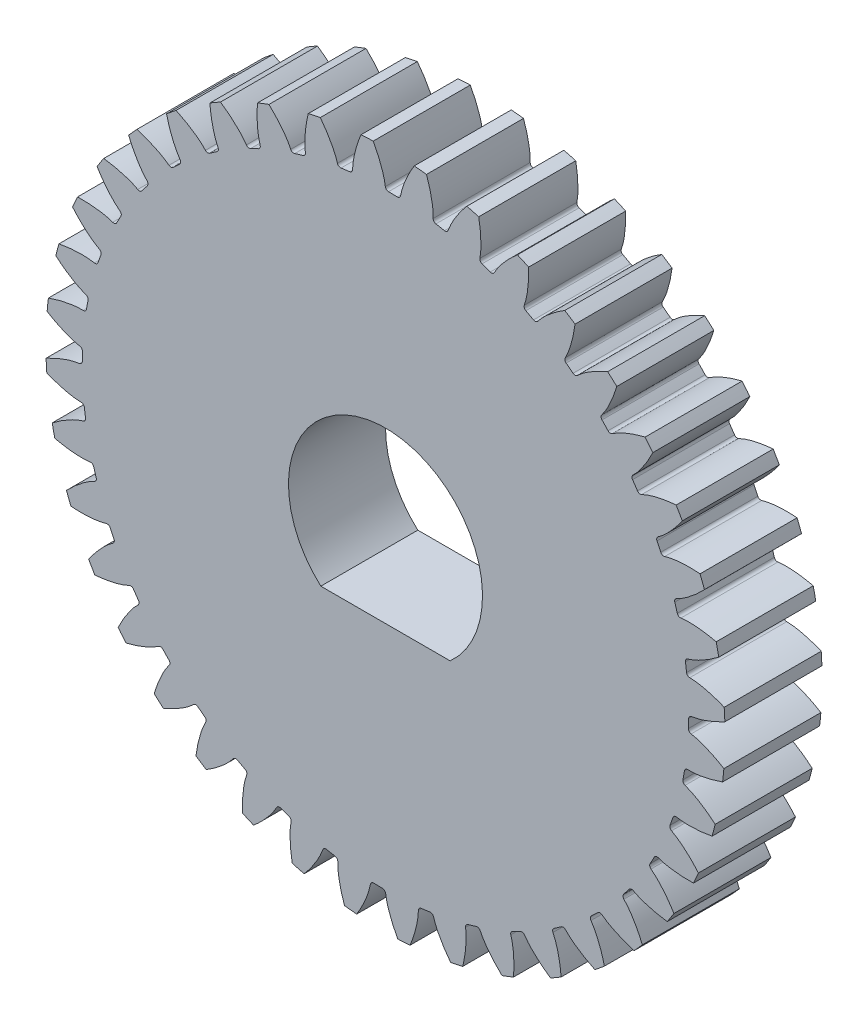
from build123d import *

# Parameters (mm, degrees)
SKETCH1_R                 = 10.5
BOSS_EXTRUDE1_DEPTH       = 3
CUT_EXTRUDE1_DEPTH        = 16.149257408
FILLET1_R                 = 0.1
FILLET2_R                 = 0.1
CIRPATTERN14_COUNT        = 40
FILLET1_OF_CIRPATTERN14_R = 0.1
FILLET2_OF_CIRPATTERN14_R = 0.1


with BuildPart() as part:
    # Sketch1 → Boss-Extrude1 (new body)
    with BuildSketch(Plane.XY):
        Circle(SKETCH1_R)
        with BuildLine():
            Line((-2, -2.236067977), (2, -2.236067977))
            ThreePointArc((2, -2.236067977), (0, 3), (-2, -2.236067977))
        make_face(mode=Mode.SUBTRACT)
    extrude(amount=BOSS_EXTRUDE1_DEPTH)

    # Sketch3 → Cut-Extrude1 (cut, symmetric)
    with BuildSketch(Plane.XY):
        with BuildLine():
            Line((9.396926208, 0), (9.375, 0))
            ThreePointArc((9.375, 0), (9.372217268, -0.228404189), (9.363870726, -0.456672786))
            Line((9.363870726, -0.456672786), (9.385770904, -0.45774085))
            add(Edge.make_bspline(
                [(9.385770904, -0.45774085), (9.388977215, -0.457943492), (9.397960888, -0.458654691), (9.414905327, -0.460563121), (9.442478718, -0.464476435), (9.47748544, -0.470635501), (9.52255904, -0.479939311), (9.575407121, -0.492622222), (9.63319062, -0.50835926), (9.69570317, -0.527414092), (9.757728925, -0.548127815), (9.819261178, -0.570369728), (9.880232496, -0.593946192), (9.953677701, -0.624174352), (10.041157255, -0.662737018), (10.142479128, -0.711159995), (10.256243532, -0.77001319), (10.351353223, -0.82324166), (10.41648326, -0.861502087), (10.453362572, -0.883819497), (10.462276562, -0.88925201)],
                knots=[0, 0, 0, 0, 0, 0.005376749, 0.015083688, 0.02853182, 0.04661014, 0.064854849, 0.092110525, 0.119476176, 0.146842496, 0.174208854, 0.201574956, 0.228941013, 0.256307345, 0.307035032, 0.361767352, 0.416499661, 0.471231937, 0.488701645, 0.488701645, 0.488701645, 0.488701645, 0.488701645], degree=4))
            ThreePointArc((10.462276562, -0.88925201), (10.490564901, -0.445025897), (10.5, 0))
            ThreePointArc((10.5, 0), (10.498293259, 0.189310979), (10.493173591, 0.378560413))
            add(Edge.make_bspline(
                [(9.396926208, 0), (9.400138583, 4.6216e-05), (9.409146235, 0.000318961), (9.426163522, 0.001399731), (9.453894805, 0.003965251), (9.489159988, 0.008411766), (9.534633285, 0.015508917), (9.588036436, 0.025602449), (9.646517918, 0.038506069), (9.709884453, 0.054493183), (9.772845578, 0.072160933), (9.835388227, 0.091379097), (9.897435615, 0.111957553), (9.972266099, 0.138572183), (10.06152026, 0.172827787), (10.16508062, 0.216257712), (10.281576815, 0.269499377), (10.379166451, 0.318031698), (10.446082904, 0.353074106), (10.484005556, 0.373568566), (10.493173591, 0.378560413)],
                knots=[0, 0, 0, 0, 0, 0.005376749, 0.015083688, 0.02853182, 0.04661014, 0.064854849, 0.092110525, 0.119476176, 0.146842496, 0.174208854, 0.201574956, 0.228941013, 0.256307345, 0.307035032, 0.361767352, 0.416499661, 0.471231937, 0.488701645, 0.488701645, 0.488701645, 0.488701645, 0.488701645], degree=4))
        make_face()
    cut_extrude1 = extrude(amount=CUT_EXTRUDE1_DEPTH, both=True, mode=Mode.SUBTRACT)

    # Fillet1
    fillet1_edges = [part.edges().sort_by_distance(p)[0] for p in [
        (9.363870726, -0.456672786, 1.5),
    ]]
    fillet(fillet1_edges, radius=FILLET1_R)

    # Fillet2
    fillet2_edges = [part.edges().sort_by_distance(p)[0] for p in [
        (9.375, 0, 1.5),
    ]]
    fillet(fillet2_edges, radius=FILLET2_R)

    # CirPattern14: Cut-Extrude1 ×40 about axis
    cirpattern14_axis = Axis((0, 0, 3), (0, 0, -1))
    for i in range(1, CIRPATTERN14_COUNT):
        add(cut_extrude1.rotate(cirpattern14_axis, i * 360 / CIRPATTERN14_COUNT), mode=Mode.SUBTRACT)

    # Fillet1 of CirPattern14
    fillet1_of_cirpattern14_edges = [part.edges().sort_by_distance(p)[0] for p in [
        (9.177146576, -1.915882494, 1.5),
        (8.76445062, -3.327916816, 1.5),
        (8.135944802, -4.658006782, 1.5),
        (7.307105021, -5.873401162, 1.5),
        (6.298340065, -6.944172912, 1.5),
        (5.134489072, -7.843956079, 1.5),
        (3.844209919, -8.550595015, 1.5),
        (2.459273558, -9.046689923, 1.5),
        (1.013781722, -9.320025302, 1.5),
        (-0.456672786, -9.363870726, 1.5),
        (-1.915882494, -9.177146576, 1.5),
        (-3.327916816, -8.76445062, 1.5),
        (-4.658006782, -8.135944802, 1.5),
        (-5.873401162, -7.307105021, 1.5),
        (-6.944172912, -6.298340065, 1.5),
        (-7.843956079, -5.134489072, 1.5),
        (-8.550595015, -3.844209919, 1.5),
        (-9.046689923, -2.459273558, 1.5),
        (-9.320025302, -1.013781722, 1.5),
        (-9.363870726, 0.456672786, 1.5),
        (-9.177146576, 1.915882494, 1.5),
        (-8.76445062, 3.327916816, 1.5),
        (-8.135944802, 4.658006782, 1.5),
        (-7.307105021, 5.873401162, 1.5),
        (-6.298340065, 6.944172912, 1.5),
        (-5.134489072, 7.843956079, 1.5),
        (-3.844209919, 8.550595015, 1.5),
        (-2.459273558, 9.046689923, 1.5),
        (-1.013781722, 9.320025302, 1.5),
        (0.456672786, 9.363870726, 1.5),
        (1.915882494, 9.177146576, 1.5),
        (3.327916816, 8.76445062, 1.5),
        (4.658006782, 8.135944802, 1.5),
        (5.873401162, 7.307105021, 1.5),
        (6.944172912, 6.298340065, 1.5),
        (7.843956079, 5.134489072, 1.5),
        (8.550595015, 3.844209919, 1.5),
        (9.046689923, 2.459273558, 1.5),
        (9.320025302, 1.013781722, 1.5),
    ]]
    fillet(fillet1_of_cirpattern14_edges, radius=FILLET1_OF_CIRPATTERN14_R)

    # Fillet2 of CirPattern14
    fillet2_of_cirpattern14_edges = [part.edges().sort_by_distance(p)[0] for p in [
        (9.259578193, -1.46657311, 1.5),
        (8.91615484, -2.897034322, 1.5),
        (8.353186164, -4.256160935, 1.5),
        (7.584534322, -5.51048674, 1.5),
        (6.629126074, -6.629126074, 1.5),
        (5.51048674, -7.584534322, 1.5),
        (4.256160935, -8.353186164, 1.5),
        (2.897034322, -8.91615484, 1.5),
        (1.46657311, -9.259578193, 1.5),
        (0, -9.375, 1.5),
        (-1.46657311, -9.259578193, 1.5),
        (-2.897034322, -8.91615484, 1.5),
        (-4.256160935, -8.353186164, 1.5),
        (-5.51048674, -7.584534322, 1.5),
        (-6.629126074, -6.629126074, 1.5),
        (-7.584534322, -5.51048674, 1.5),
        (-8.353186164, -4.256160935, 1.5),
        (-8.91615484, -2.897034322, 1.5),
        (-9.259578193, -1.46657311, 1.5),
        (-9.375, 0, 1.5),
        (-9.259578193, 1.46657311, 1.5),
        (-8.91615484, 2.897034322, 1.5),
        (-8.353186164, 4.256160935, 1.5),
        (-7.584534322, 5.51048674, 1.5),
        (-6.629126074, 6.629126074, 1.5),
        (-5.51048674, 7.584534322, 1.5),
        (-4.256160935, 8.353186164, 1.5),
        (-2.897034322, 8.91615484, 1.5),
        (-1.46657311, 9.259578193, 1.5),
        (0, 9.375, 1.5),
        (1.46657311, 9.259578193, 1.5),
        (2.897034322, 8.91615484, 1.5),
        (4.256160935, 8.353186164, 1.5),
        (5.51048674, 7.584534322, 1.5),
        (6.629126074, 6.629126074, 1.5),
        (7.584534322, 5.51048674, 1.5),
        (8.353186164, 4.256160935, 1.5),
        (8.91615484, 2.897034322, 1.5),
        (9.259578193, 1.46657311, 1.5),
    ]]
    fillet(fillet2_of_cirpattern14_edges, radius=FILLET2_OF_CIRPATTERN14_R)


solid = part.part
